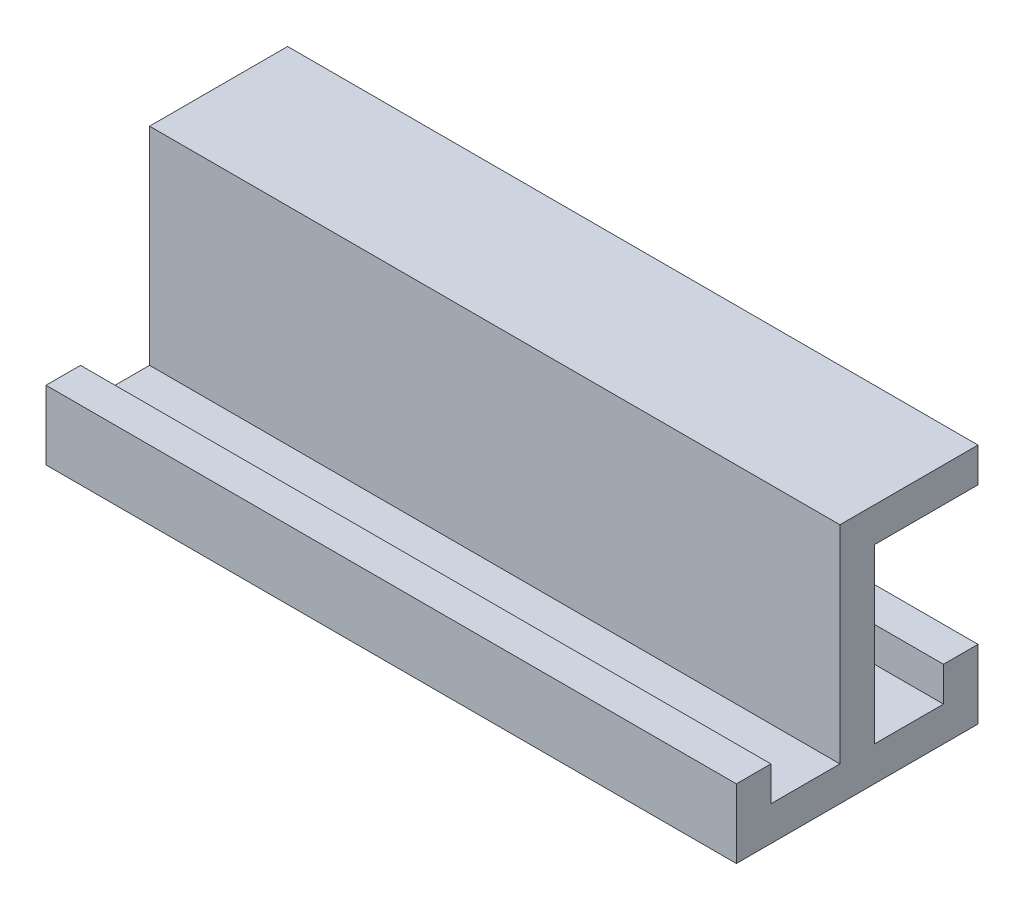
from build123d import *

# Parameters (mm, degrees)
SKETCH_1_W      = 30
SKETCH_1_H      = 10
SKETCH_1_W_2    = 70
SKETCH_1_W_3    = 10
EXTRUDE_1_DEPTH = 100


with BuildPart() as part:
    # Эскиз1 → Бобышка-Вытянуть1 (new, symmetric)
    with BuildSketch(Plane(origin=(0, 0, 0), x_dir=(0, 0, -1), z_dir=(1, 0, 0))):
        Polygon((-5, 65), (-5, 5), (5, 5), (5, 55), (5, 65), align=None)
        with Locations((20, 60)):
            Rectangle(SKETCH_1_W, SKETCH_1_H)
        Rectangle(SKETCH_1_W_2, SKETCH_1_H)
        with Locations((30, 10)):
            Rectangle(SKETCH_1_W_3, SKETCH_1_H)
        with Locations((-30, 10)):
            Rectangle(SKETCH_1_W_3, SKETCH_1_H)
    extrude(amount=EXTRUDE_1_DEPTH, both=True)


solid = part.part
